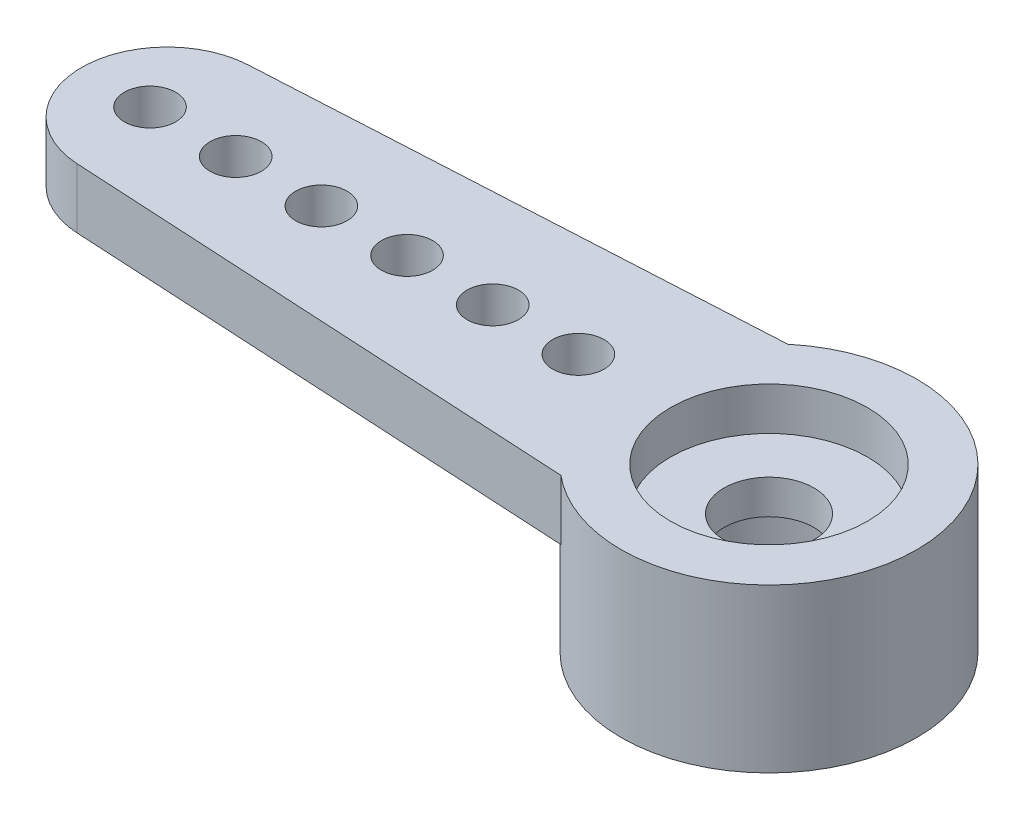
from build123d import *

# Parameters (mm, degrees)
RESSALTO_EXTRUS_O1_DEPTH = 1.4
ESBO_O2_R                = 3.45
RESSALTO_EXTRUS_O2_DEPTH = 2.4
FURO4_D                  = 1.2
PADR_O_LINEAR1_COUNT     = 6
PADR_O_LINEAR1_PITCH     = 2
FURO1_D                  = 4.95
FURO1_DEPTH              = 2
FURO2_D                  = 4.6
FURO2_DEPTH              = 1
FURO3_D                  = 2.1


with BuildPart() as part:
    # Esboço1 → Ressalto-extrusão1 (new body)
    with BuildSketch(Plane(origin=(0, 0, 0), x_dir=(1, 0, 0), z_dir=(0, 1, 0))):
        with BuildLine():
            Line((-14.159121967, 1.99702088), (-2.209072203, 2.65))
            ThreePointArc((-2.209072203, 2.65), (3.45, 0), (-2.209072203, -2.65))
            Line((-2.209072203, -2.65), (-14.159121967, -1.99702088))
            ThreePointArc((-14.159121967, -1.99702088), (-16.05, 0), (-14.159121967, 1.99702088))
        make_face()
    extrude(amount=-RESSALTO_EXTRUS_O1_DEPTH)

    # Esboço2 → Ressalto-extrusão2 (add)
    with BuildSketch(Plane.XZ.offset(1.4)):
        with Locations(Location((0, 0, 0), (0, 0, 90))):
            Circle(ESBO_O2_R)
    extrude(amount=RESSALTO_EXTRUS_O2_DEPTH)

    # Furo4 (through all)
    with Locations(Plane(origin=(0, 0, 0), x_dir=(1, 0, 0), z_dir=(0, 1, 0))):
        with Locations((-14.45, 0)):
            furo4 = Hole(FURO4_D / 2)

    # Padrão linear1: Furo4 ×6
    with Locations(*[(i * PADR_O_LINEAR1_PITCH, 0, 0) for i in range(1, PADR_O_LINEAR1_COUNT)]):
        add(furo4, mode=Mode.SUBTRACT)

    # Furo1
    with Locations(Plane(origin=(0, -3.8, 0), x_dir=(-1, 0, 0), z_dir=(0, -1, 0))):
        with Locations((0, 0)):
            Hole(FURO1_D / 2, depth=FURO1_DEPTH)

    # Furo2
    with Locations(Plane(origin=(0, 0, 0), x_dir=(1, 0, 0), z_dir=(0, 1, 0))):
        with Locations((0, 0)):
            Hole(FURO2_D / 2, depth=FURO2_DEPTH)

    # Furo3 (through all)
    with Locations(Plane(origin=(0, 0, 0), x_dir=(1, 0, 0), z_dir=(0, 1, 0))):
        with Locations((0, 0)):
            Hole(FURO3_D / 2)


solid = part.part
